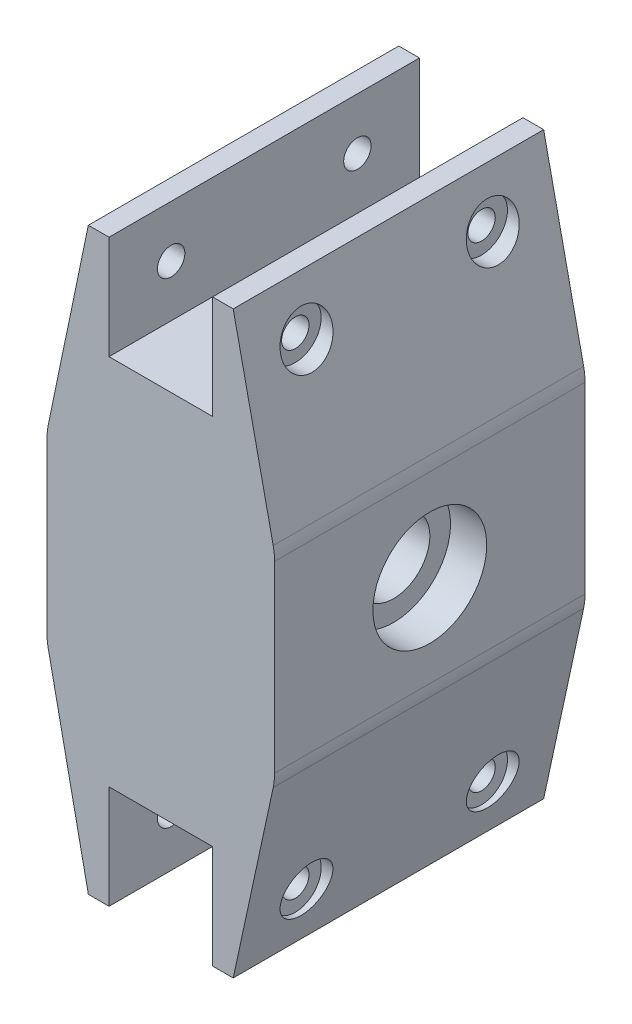
from build123d import *

# Parameters (mm, degrees)
BOSS_EXTRUDE1_DEPTH                     = 60
SKETCH2_W                               = 20
SKETCH2_H                               = 20
CUT_EXTRUDE1_DEPTH                      = 85.970583145
SKETCH3_W                               = 20
SKETCH3_H                               = 20
CUT_EXTRUDE2_DEPTH                      = 85.970583145
CBORE_FOR_M5_HEX_HEAD_BOLT1_D           = 5.3
CBORE_FOR_M5_HEX_HEAD_BOLT1_DEPTH       = 7.243243243
CBORE_FOR_M5_HEX_HEAD_BOLT1_CBORE_D     = 10
CBORE_FOR_M5_HEX_HEAD_BOLT1_CBORE_DEPTH = 3.243243243
CBORE_FOR_M5_HEX_HEAD_BOLT2_D           = 5.3
CBORE_FOR_M5_HEX_HEAD_BOLT2_DEPTH       = 39.116883117
CBORE_FOR_M5_HEX_HEAD_BOLT2_CBORE_D     = 10
CBORE_FOR_M5_HEX_HEAD_BOLT2_CBORE_DEPTH = 3.116883117
FILLET1_R                               = 12


with BuildPart() as part:
    # Sketch1 → Boss-Extrude1 (new body)
    with BuildSketch(Plane.XY.offset(60)):
        Polygon((14, 56), (-14, 56), (-22, 17.5), (-22, -17.5), (-14, -56), (14, -56), (22, -19), (22, 19), align=None)
    extrude(amount=-BOSS_EXTRUDE1_DEPTH)

    # Sketch2 → Cut-Extrude1 (cut, through all)
    with BuildSketch(Plane(origin=(0, 0, 0), x_dir=(-1, 0, 0), z_dir=(0, 0, -1))):
        with Locations((0, 46)):
            Rectangle(SKETCH2_W, SKETCH2_H)
    extrude(amount=-CUT_EXTRUDE1_DEPTH, mode=Mode.SUBTRACT)

    # Sketch3 → Cut-Extrude2 (cut, through all)
    with BuildSketch(Plane(origin=(0, 0, 0), x_dir=(-1, 0, 0), z_dir=(0, 0, -1))):
        with Locations((0, -46)):
            Rectangle(SKETCH3_W, SKETCH3_H)
    extrude(amount=-CUT_EXTRUDE2_DEPTH, mode=Mode.SUBTRACT)

    # Sketch4 → Cut-Revolve1 (revolve, cut)
    with BuildSketch(Plane(origin=(0, 0, 30), x_dir=(-1, 0, 0), z_dir=(0, 0, -1)), mode=Mode.PRIVATE) as cut_revolve1_sk:
        Polygon((-22, 11), (-22, 0), (22, 0), (22, 11), (15, 11), (15, 7), (-15, 7), (-15, 11), align=None)
    revolve(cut_revolve1_sk.sketch.rotate(Axis((22, 0, 30), (-1, 0, 0)), 270), axis=Axis((22, 0, 30), (-1, 0, 0)), mode=Mode.SUBTRACT)

    # CBORE for M5 Hex Head Bolt1
    with Locations(Plane(origin=(17.243243243, 0, 0), x_dir=(0, 0, -1), z_dir=(1, 0, 0))):
        with Locations((-48, 46), (-12, 46), (-48, -46), (-12, -46)):
            CounterBoreHole(CBORE_FOR_M5_HEX_HEAD_BOLT1_D / 2, CBORE_FOR_M5_HEX_HEAD_BOLT1_CBORE_D / 2, CBORE_FOR_M5_HEX_HEAD_BOLT1_CBORE_DEPTH, depth=CBORE_FOR_M5_HEX_HEAD_BOLT1_DEPTH)

    # CBORE for M5 Hex Head Bolt2
    with Locations(Plane.ZY.offset(17.116883117)):
        with Locations((48, 46), (12, 46), (48, -46), (12, -46)):
            CounterBoreHole(CBORE_FOR_M5_HEX_HEAD_BOLT2_D / 2, CBORE_FOR_M5_HEX_HEAD_BOLT2_CBORE_D / 2, CBORE_FOR_M5_HEX_HEAD_BOLT2_CBORE_DEPTH, depth=CBORE_FOR_M5_HEX_HEAD_BOLT2_DEPTH)

    # Fillet1
    fillet1_edges = [part.edges().sort_by_distance(p)[0] for p in [
        (22, 19, 30),
        (22, -19, 30),
        (-22, -17.5, 30),
        (-22, 17.5, 30),
    ]]
    fillet(fillet1_edges, radius=FILLET1_R)


solid = part.part
